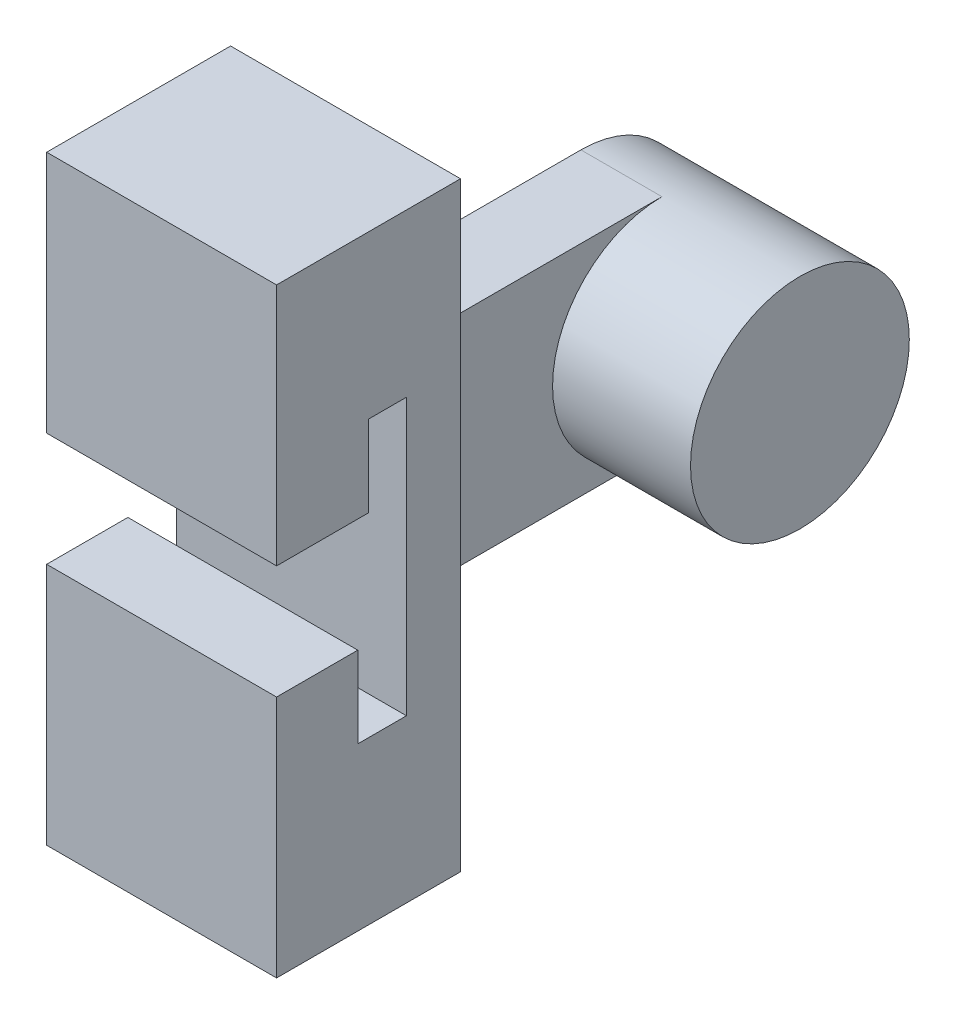
from build123d import *

# Parameters (mm, degrees)
SKETCH1_R           = 30.21838041
BOSS_EXTRUDE1_DEPTH = 38.1
BOSS_EXTRUDE2_START = 22.394673824
BOSS_EXTRUDE2_DEPTH = 22.394673824
SKETCH4_W           = 63.5
SKETCH4_H           = 76.2
BOSS_EXTRUDE4_DEPTH = 14.929782549
SKETCH5_W           = 63.5
SKETCH5_H           = 50.8
BOSS_EXTRUDE5_DEPTH = 44.789347647
SKETCH7_W           = 63.5
SKETCH7_H           = 25.4
BOSS_EXTRUDE7_DEPTH = 22.41804
SKETCH8_W           = 63.5
SKETCH8_H           = 22.42566
BOSS_EXTRUDE8_DEPTH = 22.41804


with BuildPart() as part:
    # Sketch1 → Boss-Extrude1 (new body)
    with BuildSketch(Plane.YZ):
        with Locations(Location((0, 0, 0), (0, 0, 90))):
            Circle(SKETCH1_R)
    extrude(amount=BOSS_EXTRUDE1_DEPTH)

    # Sketch2 → Boss-Extrude2 (add)
    with BuildSketch(Plane(origin=(0, 0, 0), x_dir=(0, -1, 0), z_dir=(-1, 0, 0)).offset(BOSS_EXTRUDE2_START)):
        with BuildLine():
            Line((-30.21838041, 0), (-30.21838041, 76.2))
            Line((-30.21838041, 76.2), (30.21838041, 76.2))
            Line((30.21838041, 76.2), (30.21838041, 0))
            ThreePointArc((30.21838041, 0), (0, -30.21838041), (-30.21838041, 0))
        make_face()
    extrude(amount=-BOSS_EXTRUDE2_DEPTH)

    # Sketch4 → Boss-Extrude4 (add)
    with BuildSketch(Plane.XY.offset(76.2)):
        with Locations((-11.197336912, 0)):
            Rectangle(SKETCH4_W, SKETCH4_H)
    extrude(amount=BOSS_EXTRUDE4_DEPTH)

    # Sketch5 → Boss-Extrude5 (add)
    with BuildSketch(Plane(origin=(0, 38.1, 0), x_dir=(-1, 0, 0), z_dir=(0, 1, 0))):
        with Locations((11.197336912, 101.6)):
            Rectangle(SKETCH5_W, SKETCH5_H)
    boss_extrude5 = extrude(amount=BOSS_EXTRUDE5_DEPTH)

    # Mirror1: Boss-Extrude5 across plane
    add(boss_extrude5.mirror(Plane.ZX))

    # Sketch7 → Boss-Extrude7 (add)
    with BuildSketch(Plane.XZ.offset(-38.1)):
        with Locations((-11.197336912, 114.3)):
            Rectangle(SKETCH7_W, SKETCH7_H)
    extrude(amount=BOSS_EXTRUDE7_DEPTH)

    # Sketch8 → Boss-Extrude8 (add)
    with BuildSketch(Plane(origin=(0, -38.1, 0), x_dir=(-1, 0, 0), z_dir=(0, 1, 0))):
        with Locations((11.197336912, 115.78717)):
            Rectangle(SKETCH8_W, SKETCH8_H)
    extrude(amount=BOSS_EXTRUDE8_DEPTH)


solid = part.part
